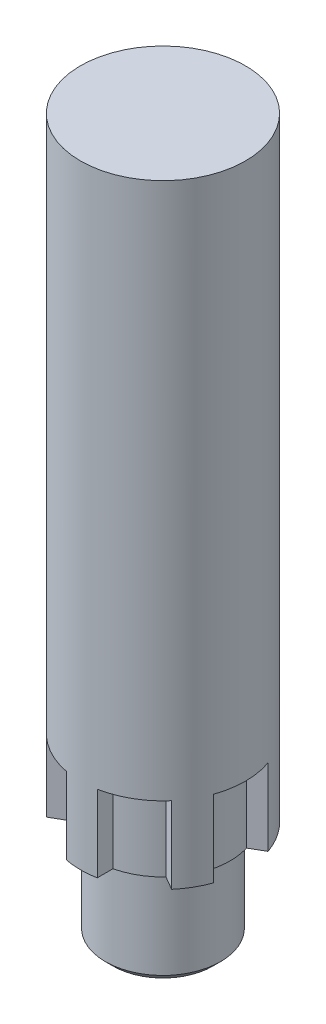
from build123d import *

# Parameters (mm, degrees)
SKETCH1_R           = 21.5
BOSS_EXTRUDE1_DEPTH = 160
CUT_EXTRUDE1_START  = -20
CUT_EXTRUDE1_DEPTH  = 20
SKETCH4_R           = 15
BOSS_EXTRUDE2_DEPTH = 26
CHAMFER1_SIZE       = 2


with BuildPart() as part:
    # Sketch1 → Boss-Extrude1 (new body)
    with BuildSketch(Plane(origin=(0, 0, 0), x_dir=(1, 0, 0), z_dir=(0, 1, 0))):
        with Locations(Location((0, 0, 0), (0, 0, 270))):
            Circle(SKETCH1_R)
    extrude(amount=-BOSS_EXTRUDE1_DEPTH)

    # Sketch3 → Cut-Extrude1 (cut)
    with BuildSketch(Plane.XZ.offset(160).offset(CUT_EXTRUDE1_START)):
        with BuildLine():
            Line((-4, 17.036725037), (-4, 21.124630174))
            ThreePointArc((-4, 21.124630174), (-10.75, 18.619546181), (-16.294466376, 14.026416702))
            Line((-16.294466376, 14.026416702), (-12.75423668, 11.982464134))
            ThreePointArc((-12.75423668, 11.982464134), (-8.75, 15.155444566), (-4, 17.036725037))
        make_face()
        with BuildLine():
            ThreePointArc((16.294466376, 14.026416702), (10.75, 18.619546181), (4, 21.124630174))
            Line((4, 21.124630174), (4, 17.036725037))
            ThreePointArc((4, 17.036725037), (8.75, 15.155444566), (12.75423668, 11.982464134))
            Line((12.75423668, 11.982464134), (16.294466376, 14.026416702))
        make_face()
        with BuildLine():
            ThreePointArc((21.5, 0), (21.196474083, 3.599928673), (20.294466376, 7.098213472))
            Line((20.294466376, 7.098213472), (16.75423668, 5.054260904))
            ThreePointArc((16.75423668, 5.054260904), (17.5, 0), (16.75423668, -5.054260904))
            Line((16.75423668, -5.054260904), (20.294466376, -7.098213472))
            ThreePointArc((20.294466376, -7.098213472), (21.196474083, -3.599928673), (21.5, 0))
        make_face()
        with BuildLine():
            Line((-16.75423668, 5.054260904), (-20.294466376, 7.098213472))
            ThreePointArc((-20.294466376, 7.098213472), (-21.5, 0), (-20.294466376, -7.098213472))
            Line((-20.294466376, -7.098213472), (-16.75423668, -5.054260904))
            ThreePointArc((-16.75423668, -5.054260904), (-17.5, 0), (-16.75423668, 5.054260904))
        make_face()
        with BuildLine():
            Line((-12.75423668, -11.982464134), (-16.294466376, -14.026416702))
            ThreePointArc((-16.294466376, -14.026416702), (-10.75, -18.619546181), (-4, -21.124630174))
            Line((-4, -21.124630174), (-4, -17.036725037))
            ThreePointArc((-4, -17.036725037), (-8.75, -15.155444566), (-12.75423668, -11.982464134))
        make_face()
        with BuildLine():
            Line((4, -17.036725037), (4, -21.124630174))
            ThreePointArc((4, -21.124630174), (10.75, -18.619546181), (16.294466376, -14.026416702))
            Line((16.294466376, -14.026416702), (12.75423668, -11.982464134))
            ThreePointArc((12.75423668, -11.982464134), (8.75, -15.155444566), (4, -17.036725037))
        make_face()
    extrude(amount=CUT_EXTRUDE1_DEPTH, mode=Mode.SUBTRACT)

    # Sketch4 → Boss-Extrude2 (add)
    with BuildSketch(Plane.XZ.offset(160)):
        with Locations(Location((0, 0, 0), (0, 0, 90))):
            Circle(SKETCH4_R)
    extrude(amount=BOSS_EXTRUDE2_DEPTH)

    # Chamfer1
    chamfer1_edges = [part.edges().sort_by_distance(p)[0] for p in [
        (0, -186, -15),
    ]]
    chamfer(chamfer1_edges, length=CHAMFER1_SIZE)


solid = part.part
